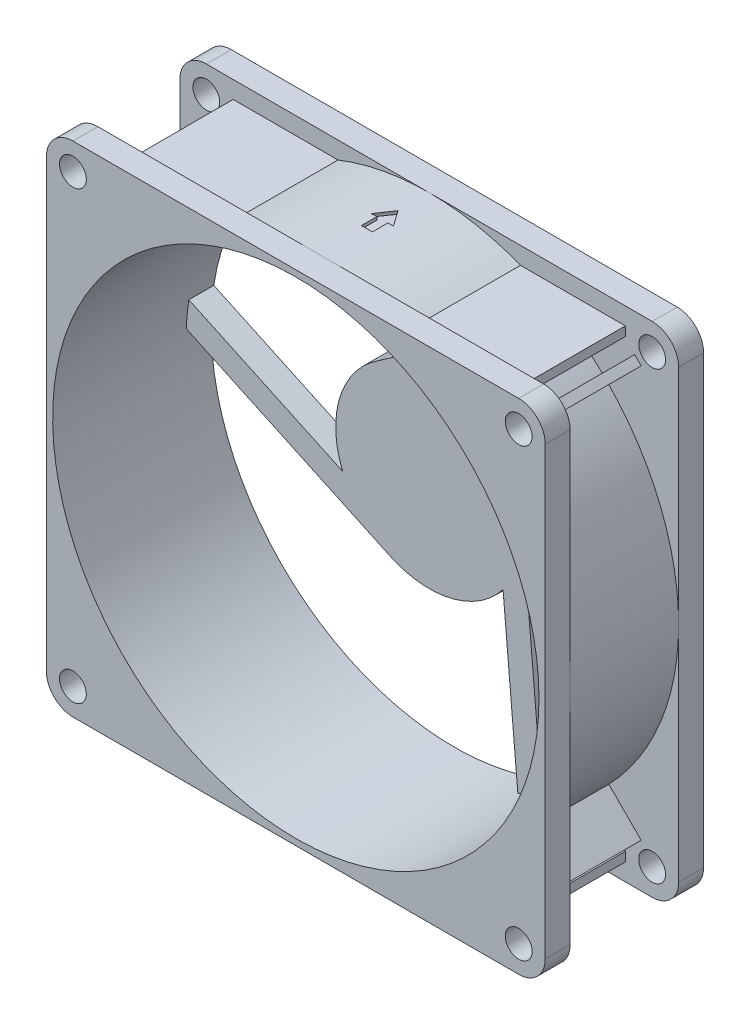
from build123d import *

# Parameters (mm, degrees)
SKETCH_BODY_R                       = 39
BODY_DEPTH                          = 25.4
SKETCH_CUT_BODY_W                   = 17.4
SKETCH_CUT_BODY_H                   = 14.808134855
REINFORCMENT_STRIP_REACH            = 64.009
CIRPATTERN_REINFORCMENT_STRIP_COUNT = 4
SKETCH_FIXING_HOLE_R                = 2.15
FIXING_HOLE_DEPTH                   = 63.009354133
CIRPATTERN_FIXING_HOLE_COUNT        = 4
BONE_DEPTH                          = 4
CIRPATTERN_BONE_COUNT               = 3
REINFORCMENT_PLATES_REACH           = 64.009
SKETCH_FIXING_PLATE_FAN_R           = 15
FIXING_PLATE_FAN_DEPTH              = 4
AIR_EXHAUST_DEPTH                   = 93.549500269


with BuildPart() as part:
    # Sketch-Body → Body (new body)
    with BuildSketch(Plane.XY):
        with BuildLine():
            Line((-35.75, -40), (35.75, -40))
            ThreePointArc((35.75, -40), (38.75520382, -38.75520382), (40, -35.75))
            Line((40, -35.75), (40, 35.75))
            ThreePointArc((40, 35.75), (38.75520382, 38.75520382), (35.75, 40))
            Line((35.75, 40), (-35.75, 40))
            ThreePointArc((-35.75, 40), (-38.75520382, 38.75520382), (-40, 35.75))
            Line((-40, 35.75), (-40, -35.75))
            ThreePointArc((-40, -35.75), (-38.75520382, -38.75520382), (-35.75, -40))
        make_face()
        Circle(SKETCH_BODY_R, mode=Mode.SUBTRACT)
    extrude(amount=BODY_DEPTH)

    # Sketch-Cut-Body → Cut-Body (revolve, cut)
    with BuildSketch(Plane(origin=(0, 0, 0), x_dir=(0, 0, -1), z_dir=(1, 0, 0)), mode=Mode.PRIVATE) as cut_body_sk:
        with Locations((-12.7, 47.404067428)):
            Rectangle(SKETCH_CUT_BODY_W, SKETCH_CUT_BODY_H)
    revolve(cut_body_sk.sketch.rotate(Axis((0, 0, 25.4), (0, 0, -1)), 180), axis=Axis((0, 0, 25.4), (0, 0, -1)), mode=Mode.SUBTRACT)

    # Sketch-Reinforcment-Strip → Reinforcment-Strip (add, up to next)
    with BuildSketch(Plane.XY, mode=Mode.PRIVATE) as reinforcment_strip_sk1:
        with BuildLine():
            Line((28.801838692, 27.757054743), (33.991972605, 32.947188656))
            Line((33.991972605, 32.947188656), (32.947188656, 33.991972605))
            Line((32.947188656, 33.991972605), (27.757054743, 28.801838692))
            ThreePointArc((27.757054743, 28.801838692), (28.284271247, 28.284271247), (28.801838692, 27.757054743))
        make_face()
    reinforcment_strip_tool1 = extrude(reinforcment_strip_sk1.sketch, amount=REINFORCMENT_STRIP_REACH, mode=Mode.PRIVATE) - part.part
    reinforcment_strip = reinforcment_strip_tool1.solids().sort_by_distance((30.876122, 30.876122, 0))[0]
    add(reinforcment_strip)

    # CirPattern-Reinforcment-Strip: Reinforcment-Strip ×4 about axis
    cirpattern_reinforcment_strip_axis = Axis((0, 0, 0), (0, 0, 1))
    for i in range(1, CIRPATTERN_REINFORCMENT_STRIP_COUNT):
        add(reinforcment_strip.rotate(cirpattern_reinforcment_strip_axis, i * 360 / CIRPATTERN_REINFORCMENT_STRIP_COUNT))

    # Sketch-Fixing-Hole → Fixing-Hole (cut, through all)
    with BuildSketch(Plane.XY):
        with Locations(Location((35.75, 35.75, 0), (0, 0, 90))):
            Circle(SKETCH_FIXING_HOLE_R)
    fixing_hole = extrude(amount=FIXING_HOLE_DEPTH, mode=Mode.SUBTRACT)

    # CirPattern-Fixing-Hole: Fixing-Hole ×4 about axis
    cirpattern_fixing_hole_axis = Axis((0, 0, 0), (0, 0, 1))
    for i in range(1, CIRPATTERN_FIXING_HOLE_COUNT):
        add(fixing_hole.rotate(cirpattern_fixing_hole_axis, i * 360 / CIRPATTERN_FIXING_HOLE_COUNT), mode=Mode.SUBTRACT)

    # Sketch-Bone → Bone (add)
    with BuildSketch(Plane.XY):
        with BuildLine():
            Line((14.980149429, 0.771442214), (18.07129405, -34.560502476))
            ThreePointArc((18.07129405, -34.560502476), (16.164518677, -35.492370109), (14.209874971, -36.319133433))
            Line((14.209874971, -36.319133433), (11.838280423, -9.211683702))
            ThreePointArc((11.838280423, -9.211683702), (14.308135647, -4.503027238), (14.980149429, 0.771442214))
        make_face()
    bone = extrude(amount=BONE_DEPTH)

    # CirPattern-Bone: Bone ×3 about axis
    cirpattern_bone_axis = Axis((0, 0, 0), (0, 0, 1))
    for i in range(1, CIRPATTERN_BONE_COUNT):
        add(bone.rotate(cirpattern_bone_axis, i * 360 / CIRPATTERN_BONE_COUNT))

    # Sketch3 → Reinforcment-Plates (add, up to next)
    with BuildSketch(Plane.XY, mode=Mode.PRIVATE) as reinforcment_plates_sk1:
        with BuildLine():
            Line((14.632487739, 37.227547631), (31.45, 37.227547631))
            Line((31.45, 37.227547631), (31.45, 35.75))
            Line((31.45, 35.75), (17.942616866, 35.75))
            ThreePointArc((17.942616866, 35.75), (16.304298413, 36.526289892), (14.632487739, 37.227547631))
        make_face()
    reinforcment_plates_tool1 = extrude(reinforcment_plates_sk1.sketch, amount=REINFORCMENT_PLATES_REACH, mode=Mode.PRIVATE) - part.part
    # Sketch3 → Reinforcment-Plates (add, up to next)
    with BuildSketch(Plane.XY, mode=Mode.PRIVATE) as reinforcment_plates_sk2:
        with BuildLine():
            Line((-31.45, 35.75), (-17.942616866, 35.75))
            ThreePointArc((-17.942616866, 35.75), (-16.304298413, 36.526289892), (-14.632487739, 37.227547631))
            Line((-14.632487739, 37.227547631), (-31.45, 37.227547631))
            Line((-31.45, 37.227547631), (-31.45, 35.75))
        make_face()
    reinforcment_plates_tool2 = extrude(reinforcment_plates_sk2.sketch, amount=REINFORCMENT_PLATES_REACH, mode=Mode.PRIVATE) - part.part
    # Sketch3 → Reinforcment-Plates (add, up to next)
    with BuildSketch(Plane.XY, mode=Mode.PRIVATE) as reinforcment_plates_sk3:
        with BuildLine():
            Line((-31.45, -37.227547631), (-31.45, -35.75))
            Line((-31.45, -35.75), (-17.942616866, -35.75))
            ThreePointArc((-17.942616866, -35.75), (-16.304298413, -36.526289892), (-14.632487739, -37.227547631))
            Line((-14.632487739, -37.227547631), (-31.45, -37.227547631))
        make_face()
    reinforcment_plates_tool3 = extrude(reinforcment_plates_sk3.sketch, amount=REINFORCMENT_PLATES_REACH, mode=Mode.PRIVATE) - part.part
    # Sketch3 → Reinforcment-Plates (add, up to next)
    with BuildSketch(Plane.XY, mode=Mode.PRIVATE) as reinforcment_plates_sk4:
        with BuildLine():
            Line((14.632487739, -37.227547631), (31.45, -37.227547631))
            Line((31.45, -37.227547631), (31.45, -35.75))
            Line((31.45, -35.75), (17.942616866, -35.75))
            ThreePointArc((17.942616866, -35.75), (16.304298413, -36.526289892), (14.632487739, -37.227547631))
        make_face()
    reinforcment_plates_tool4 = extrude(reinforcment_plates_sk4.sketch, amount=REINFORCMENT_PLATES_REACH, mode=Mode.PRIVATE) - part.part
    add(reinforcment_plates_tool1.solids().sort_by_distance((23.872253, 36.515707, 0))[0])
    add(reinforcment_plates_tool2.solids().sort_by_distance((-23.872253, 36.515707, 0))[0])
    add(reinforcment_plates_tool3.solids().sort_by_distance((-23.872253, -36.515707, 0))[0])
    add(reinforcment_plates_tool4.solids().sort_by_distance((23.872253, -36.515707, 0))[0])

    # Sketch-Fixing-Plate-Fan → Fixing-Plate-Fan (add)
    with BuildSketch(Plane.XY):
        Circle(SKETCH_FIXING_PLATE_FAN_R)
    extrude(amount=FIXING_PLATE_FAN_DEPTH)

    # Sketch5 → Air-Exhaust (cut, through all)
    with BuildSketch(Plane(origin=(0, 39.5, 0), x_dir=(-1, 0, 0), z_dir=(0, 1, 0))):
        Polygon((0.881634904, 14), (-0.881634904, 14), (-0.881634904, 11.5), (-1.750518846, 11.5), (0, 9), (1.750518846, 11.5), (0.881634904, 11.5), align=None)
    extrude(amount=AIR_EXHAUST_DEPTH, mode=Mode.SUBTRACT)


solid = part.part
